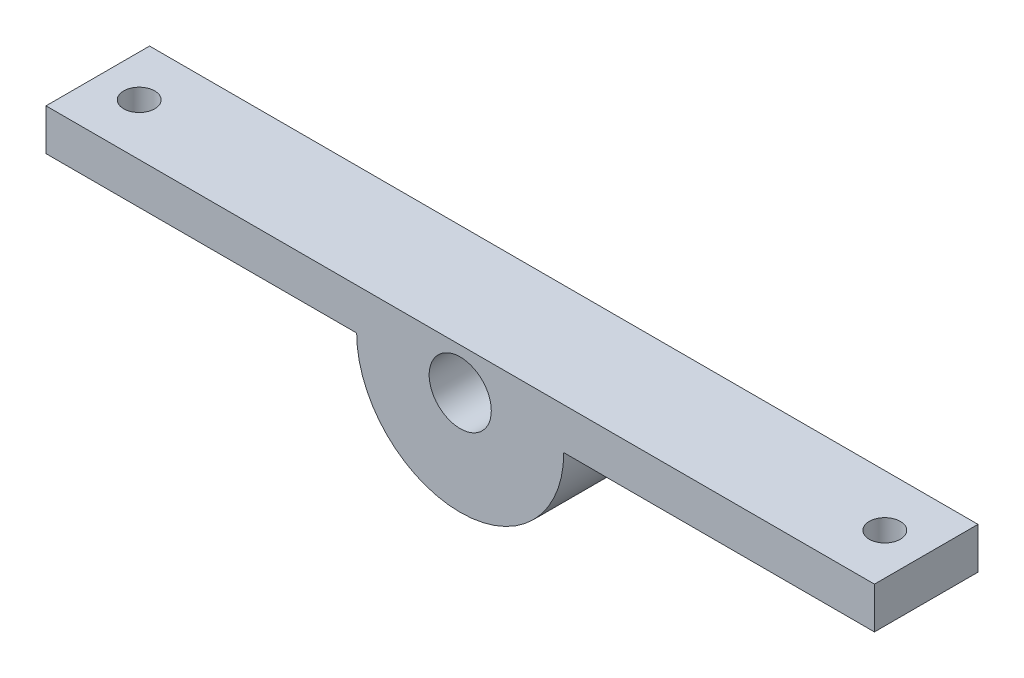
from build123d import *

# Parameters (mm, degrees)
ESQUISSE1_R             = 3
BOSS_EXTRU_1_DEPTH      = 10
ESQUISSE2_R             = 1.5
ENL_V_MAT_EXTRU_1_DEPTH = 44.543082114


with BuildPart() as part:
    # Esquisse1 → Boss.-Extru.1 (new body)
    with BuildSketch(Plane.XY):
        with BuildLine():
            Line((-10, 0), (-40, 0))
            Line((-40, 0), (-40, 4))
            Line((-40, 4), (40, 4))
            Line((40, 4), (40, 0))
            Line((40, 0), (10, 0))
            ThreePointArc((10, 0), (0, -10), (-10, 0))
        make_face()
        Circle(ESQUISSE1_R, mode=Mode.SUBTRACT)
    extrude(amount=BOSS_EXTRU_1_DEPTH)

    # Esquisse2 → Enlèv. mat.-Extru.1 (cut, through all)
    with BuildSketch(Plane(origin=(0, 4, 0), x_dir=(1, 0, 0), z_dir=(0, 1, 0))):
        with Locations(Location((-36, -5, 0), (0, 0, 270))):
            Circle(ESQUISSE2_R)
        with Locations(Location((36, -5, 0), (0, 0, 270))):
            Circle(ESQUISSE2_R)
    extrude(amount=-ENL_V_MAT_EXTRU_1_DEPTH, mode=Mode.SUBTRACT)


solid = part.part
